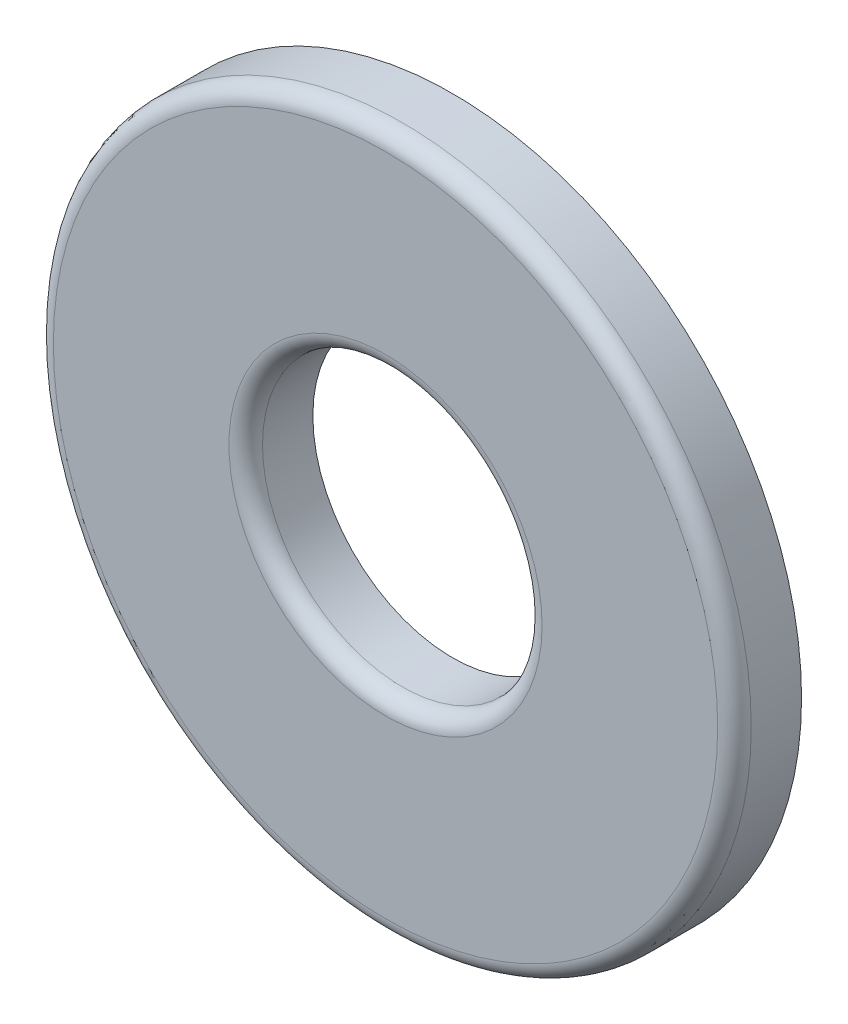
from build123d import *

# Parameters (mm, degrees)
BOSS_EXTRUDE1_DEPTH      = 0.381
BOSS_EXTRUDE1_DEPTH_BACK = 0.381
SKETCH3_R                = 3.9624
SKETCH3_R_2              = 1.5875
FILLET1_R                = 0.1905


with BuildPart() as part:
    # Sketch3 → Boss-Extrude1 (new, two sides: drawn at the far end of the back side and taken through both)
    with BuildSketch(Plane.XY.offset(-BOSS_EXTRUDE1_DEPTH_BACK)):
        with Locations(Location((0, 0, 0), (0, 0, 180))):
            Circle(SKETCH3_R)
        with Locations(Location((0, 0, 0), (0, 0, 180))):
            Circle(SKETCH3_R_2, mode=Mode.SUBTRACT)
    extrude(amount=BOSS_EXTRUDE1_DEPTH + BOSS_EXTRUDE1_DEPTH_BACK)

    # Fillet1
    fillet1_edges = [part.edges().sort_by_distance(p)[0] for p in [
        (3.9624, 0, 0.381),
        (1.5875, 0, 0.381),
    ]]
    fillet(fillet1_edges, radius=FILLET1_R)


solid = part.part
